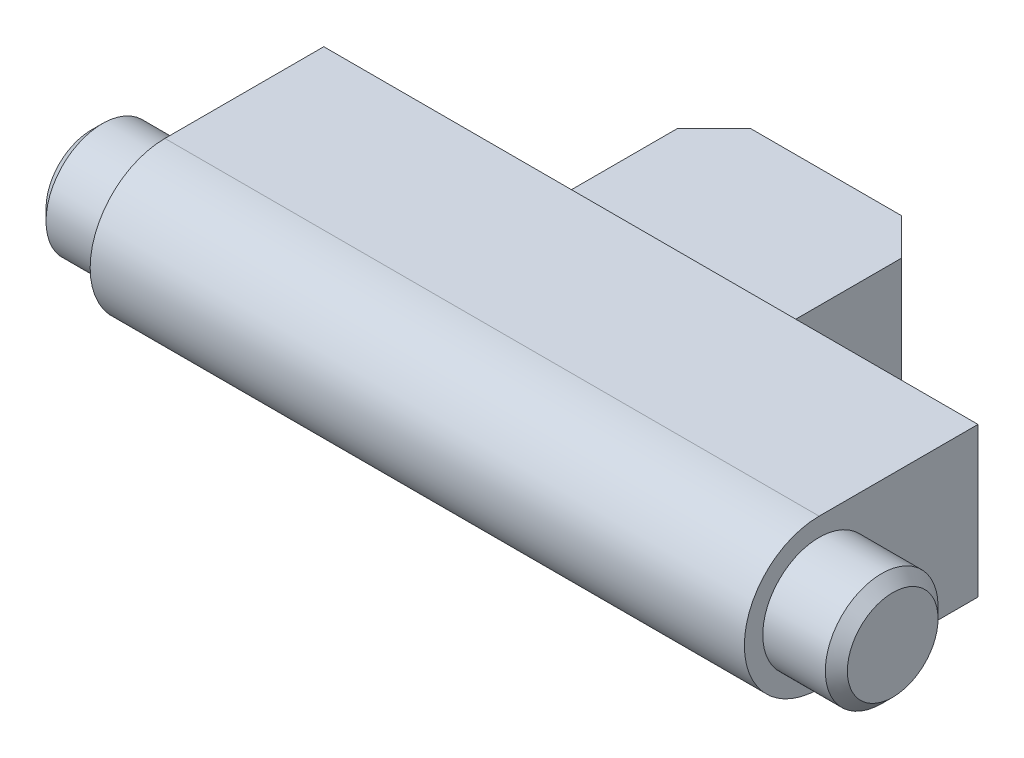
from build123d import *

# Parameters (mm, degrees)
SKETCH1_W                = 17.78
SKETCH1_H                = 4.064
BOSS_EXTRUDE1_DEPTH      = 6.35
FILLET1_RADIUS           = 2.032
FILLET1_LENGTH           = 17.78
SKETCH2_R                = 1.532
BOSS_EXTRUDE2_DEPTH      = 2
CHAMFER1_SIZE            = 0.3
CHAMFER1_OF_MIRROR1_SIZE = 0.3
SKETCH3_W                = 6.096
SKETCH3_H                = 3.048
BOSS_EXTRUDE3_DEPTH      = 4.7625
SKETCH4_W                = 6.096
SKETCH4_H                = 4.7625
BOSS_EXTRUDE4_DEPTH      = 0.127
CHAMFER2_SIZE            = 1


with BuildPart() as part:
    # Sketch1 → Boss-Extrude1 (new body)
    with BuildSketch(Plane.XY):
        with Locations((-3503.971479642, 500.3673)):
            Rectangle(SKETCH1_W, SKETCH1_H)
    extrude(amount=BOSS_EXTRUDE1_DEPTH)

    # Fillet1: full round fillet: the end face becomes a half cylinder, R = half its width
    fillet1_face = Plane((-3503.971479642, 500.3673, 6.35), x_dir=(1, 0, 0), z_dir=(0, 0, 1))  # on the end face: x along it, z out of the body
    fillet1_slab = fillet1_face.offset(-FILLET1_RADIUS / 2) * Box(FILLET1_LENGTH, 2 * FILLET1_RADIUS, FILLET1_RADIUS, mode=Mode.PRIVATE)  # the body's end, R deep
    fillet1_round = Plane((-3503.971479642, 500.3673, 4.318), x_dir=(0, 0, 1), z_dir=(1, 0, 0)) * Cylinder(FILLET1_RADIUS, FILLET1_LENGTH, mode=Mode.PRIVATE)  # its axis R under the face
    add(fillet1_slab - fillet1_round, mode=Mode.SUBTRACT)

    # Sketch2 → Boss-Extrude2 (add)
    with BuildSketch(Plane.ZY.offset(3512.861479642)):
        with Locations(Location((4.318, 500.3673, 0), (0, 0, 180))):
            Circle(SKETCH2_R)
    boss_extrude2 = extrude(amount=BOSS_EXTRUDE2_DEPTH)

    # Chamfer1
    chamfer1_edges = [part.edges().sort_by_distance(p)[0] for p in [
        (-3514.861479642, 500.3673, 5.85),
    ]]
    chamfer(chamfer1_edges, length=CHAMFER1_SIZE)

    # Mirror1: Boss-Extrude2 across plane
    add(boss_extrude2.mirror(Plane.ZY.offset(3503.971479642)))

    # Chamfer1 of Mirror1
    chamfer1_of_mirror1_edges = [part.edges().sort_by_distance(p)[0] for p in [
        (-3493.081479642, 500.3673, 5.85),
    ]]
    chamfer(chamfer1_of_mirror1_edges, length=CHAMFER1_OF_MIRROR1_SIZE)

    # Sketch3 → Boss-Extrude3 (add)
    with BuildSketch(Plane(origin=(0, 0, 0), x_dir=(-1, 0, 0), z_dir=(0, 0, -1))):
        with Locations((3503.971479642, 499.9863)):
            Rectangle(SKETCH3_W, SKETCH3_H)
    extrude(amount=BOSS_EXTRUDE3_DEPTH)

    # Sketch4 → Boss-Extrude4 (add)
    with BuildSketch(Plane.XZ.offset(-498.4623)):
        with Locations((-3503.971479642, -2.38125)):
            Rectangle(SKETCH4_W, SKETCH4_H)
    extrude(amount=BOSS_EXTRUDE4_DEPTH)

    # Chamfer2
    chamfer2_edges = [part.edges().sort_by_distance(p)[0] for p in [
        (-3500.923479642, 499.9228, -4.7625),
        (-3507.019479642, 499.9228, -4.7625),
    ]]
    chamfer(chamfer2_edges, length=CHAMFER2_SIZE)


solid = part.part
